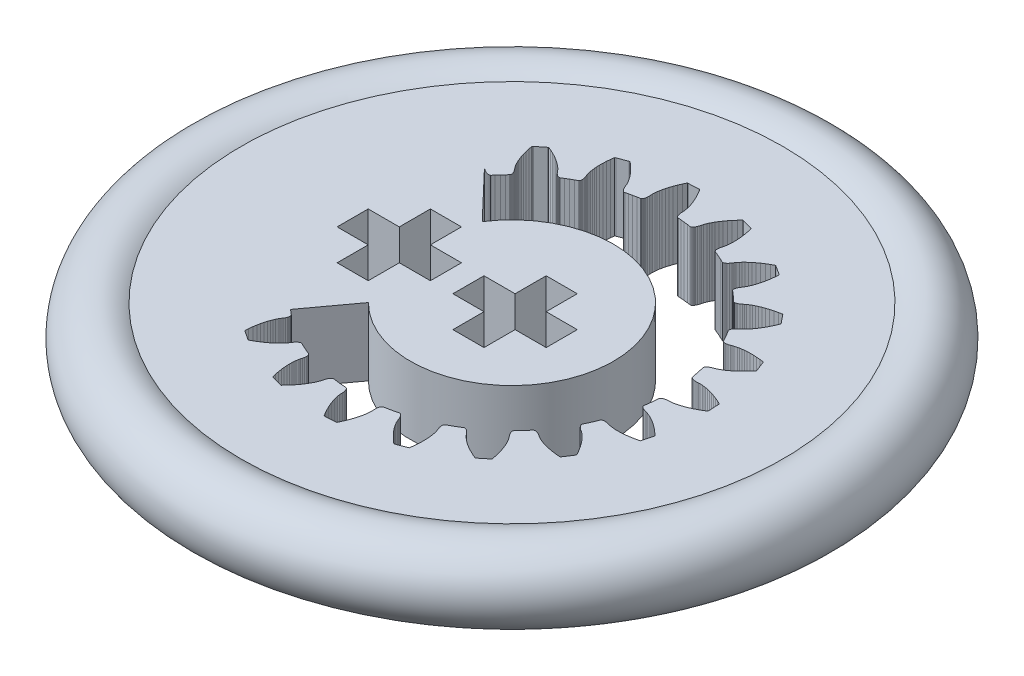
from build123d import *

# Parameters (mm, degrees)
CUT_EXTRUDE1_DEPTH = 3.81
CUT_EXTRUDE2_DEPTH = 3.81


with BuildPart() as part:
    # Sketch1 → Revolve1 (revolve)
    with BuildSketch(Plane.XY, mode=Mode.PRIVATE) as revolve1_sk:
        with BuildLine():
            Line((0, 0), (-11.938, 0))
            ThreePointArc((-11.938, 0), (-13.391464633, 1.982275638), (-11.063869511, 2.772387715))
            Line((-11.063869511, 2.772387715), (0, 2.772387715))
            Line((0, 2.772387715), (0, 0))
        make_face()
    revolve(revolve1_sk.sketch.rotate(Axis((0, 2.772387715, 0), (0, -1, 0)), 270), axis=Axis((0, 2.772387715, 0), (0, -1, 0)))

    # Sketch2 → Cut-Extrude1 (cut)
    with BuildSketch(Plane(origin=(0, 2.772387715, 0), x_dir=(1, 0, 0), z_dir=(0, 1, 0))):
        with BuildLine():
            Line((-2.93915524, -2.926183431), (-4.284595536, -4.758591682))
            Line((-4.284595536, -4.758591682), (-4.171431355, -4.858021964))
            Line((-4.171431355, -4.858021964), (-4.081176642, -4.934136064))
            Line((-4.081176642, -4.934136064), (-4.068215493, -4.948388256))
            Line((-4.068215493, -4.948388256), (-4.060784036, -4.962366284))
            Line((-4.060784036, -4.962366284), (-4.055257468, -4.979029391))
            Line((-4.055257468, -4.979029391), (-4.052769284, -4.998073857))
            Line((-4.052769284, -4.998073857), (-4.05246945, -5.019322489))
            Line((-4.05246945, -5.019322489), (-4.05520297, -5.042961191))
            Line((-4.05520297, -5.042961191), (-4.060410144, -5.068330017))
            Line((-4.060410144, -5.068330017), (-4.068538881, -5.095699183))
            Line((-4.068538881, -5.095699183), (-4.094270067, -5.155924585))
            Line((-4.094270067, -5.155924585), (-4.132073548, -5.222486974))
            Line((-4.132073548, -5.222486974), (-4.163646074, -5.268762823))
            Line((-4.163646074, -5.268762823), (-4.196070741, -5.321186598))
            Line((-4.196070741, -5.321186598), (-4.245515385, -5.417784815))
            Line((-4.245515385, -5.417784815), (-4.274333193, -5.483566779))
            Line((-4.274333193, -5.483566779), (-4.304747667, -5.561297927))
            Line((-4.304747667, -5.561297927), (-4.335379879, -5.651767425))
            Line((-4.335379879, -5.651767425), (-4.365851505, -5.755047192))
            Line((-4.365851505, -5.755047192), (-4.394647035, -5.869960289))
            Line((-4.394647035, -5.869960289), (-4.420948592, -5.997933379))
            Line((-4.420948592, -5.997933379), (-4.443804903, -6.138411436))
            Line((-4.443804903, -6.138411436), (-4.462111792, -6.291697687))
            Line((-4.462111792, -6.291697687), (-4.473990716, -6.441905705))
            Line((-4.473990716, -6.441905705), (-4.440589277, -6.464837711))
            Line((-4.440589277, -6.464837711), (-4.099968973, -6.685936383))
            Line((-4.099968973, -6.685936383), (-4.065323094, -6.707191768))
            Line((-4.065323094, -6.707191768), (-3.932984623, -6.635205185))
            Line((-3.932984623, -6.635205185), (-3.800343514, -6.556098794))
            Line((-3.800343514, -6.556098794), (-3.681199255, -6.478176532))
            Line((-3.681199255, -6.478176532), (-3.575348521, -6.402273348))
            Line((-3.575348521, -6.402273348), (-3.481879523, -6.329053238))
            Line((-3.481879523, -6.329053238), (-3.399623961, -6.259212118))
            Line((-3.399623961, -6.259212118), (-3.32990871, -6.194404519))
            Line((-3.32990871, -6.194404519), (-3.270878963, -6.135127436))
            Line((-3.270878963, -6.135127436), (-3.222731675, -6.082115924))
            Line((-3.222731675, -6.082115924), (-3.154611974, -5.997707848))
            Line((-3.154611974, -5.997707848), (-3.119748154, -5.946732833))
            Line((-3.119748154, -5.946732833), (-3.090202601, -5.899118668))
            Line((-3.090202601, -5.899118668), (-3.044937433, -5.837353527))
            Line((-3.044937433, -5.837353527), (-3.000484944, -5.789338021))
            Line((-3.000484944, -5.789338021), (-2.978731163, -5.770803146))
            Line((-2.978731163, -5.770803146), (-2.95753217, -5.755712702))
            Line((-2.95753217, -5.755712702), (-2.93713021, -5.743596824))
            Line((-2.93713021, -5.743596824), (-2.917660906, -5.735236449))
            Line((-2.917660906, -5.735236449), (-2.899402654, -5.729747067))
            Line((-2.899402654, -5.729747067), (-2.88179859, -5.728073078))
            Line((-2.88179859, -5.728073078), (-2.865747221, -5.729171175))
            Line((-2.865747221, -5.729171175), (-2.847361771, -5.735297691))
            Line((-2.847361771, -5.735297691), (-2.741728563, -5.786773021))
            Line((-2.741728563, -5.786773021), (-2.604368171, -5.849540156))
            Line((-2.604368171, -5.849540156), (-2.465798567, -5.909443171))
            Line((-2.465798567, -5.909443171), (-2.356725547, -5.953851466))
            Line((-2.356725547, -5.953851466), (-2.339994032, -5.963127899))
            Line((-2.339994032, -5.963127899), (-2.328595368, -5.974170891))
            Line((-2.328595368, -5.974170891), (-2.318094977, -5.988566279))
            Line((-2.318094977, -5.988566279), (-2.309935487, -6.005927512))
            Line((-2.309935487, -6.005927512), (-2.30298889, -6.026166606))
            Line((-2.30298889, -6.026166606), (-2.298281955, -6.048993714))
            Line((-2.298281955, -6.048993714), (-2.295642976, -6.074867164))
            Line((-2.295642976, -6.074867164), (-2.294903857, -6.103434403))
            Line((-2.294903857, -6.103434403), (-2.300383236, -6.168673939))
            Line((-2.300383236, -6.168673939), (-2.316204399, -6.243931732))
            Line((-2.316204399, -6.243931732), (-2.331784498, -6.297680867))
            Line((-2.331784498, -6.297680867), (-2.346563412, -6.357233108))
            Line((-2.346563412, -6.357233108), (-2.363669895, -6.46449165))
            Line((-2.363669895, -6.46449165), (-2.370819398, -6.535689387))
            Line((-2.370819398, -6.535689387), (-2.375258252, -6.619578126))
            Line((-2.375258252, -6.619578126), (-2.376800472, -6.714639409))
            Line((-2.376800472, -6.714639409), (-2.373750212, -6.82251306))
            Line((-2.373750212, -6.82251306), (-2.365509238, -6.940966438))
            Line((-2.365509238, -6.940966438), (-2.351144658, -7.070639744))
            Line((-2.351144658, -7.070639744), (-2.329293513, -7.211117715))
            Line((-2.329293513, -7.211117715), (-2.299539941, -7.362497056))
            Line((-2.299539941, -7.362497056), (-2.264164383, -7.509382053))
            Line((-2.264164383, -7.509382053), (-2.22537787, -7.520982381))
            Line((-2.22537787, -7.520982381), (-1.833669602, -7.625940295))
            Line((-1.833669602, -7.625940295), (-1.793867153, -7.635397816))
            Line((-1.793867153, -7.635397816), (-1.690132005, -7.52578742))
            Line((-1.690132005, -7.52578742), (-1.588331502, -7.409657887))
            Line((-1.588331502, -7.409657887), (-1.499512353, -7.298833932))
            Line((-1.499512353, -7.298833932), (-1.421823429, -7.193826288))
            Line((-1.421823429, -7.193826288), (-1.355528544, -7.095344734))
            Line((-1.355528544, -7.095344734), (-1.299293599, -7.003356506))
            Line((-1.299293599, -7.003356506), (-1.25268638, -6.920370353))
            Line((-1.25268638, -6.920370353), (-1.215067047, -6.845372296))
            Line((-1.215067047, -6.845372296), (-1.185591134, -6.780156903))
            Line((-1.185591134, -6.780156903), (-1.146845208, -6.678696632))
            Line((-1.146845208, -6.678696632), (-1.129455822, -6.619843865))
            Line((-1.129455822, -6.619843865), (-1.116074015, -6.565505699))
            Line((-1.116074015, -6.565505699), (-1.092077952, -6.492438364))
            Line((-1.092077952, -6.492438364), (-1.064615646, -6.433089136))
            Line((-1.064615646, -6.433089136), (-1.04969193, -6.408718741))
            Line((-1.04969193, -6.408718741), (-1.034469782, -6.387631165))
            Line((-1.034469782, -6.387631165), (-1.01863642, -6.370307814))
            Line((-1.01863642, -6.370307814), (-1.002844427, -6.356161506))
            Line((-1.002844427, -6.356161506), (-0.986754001, -6.345298019))
            Line((-0.986754001, -6.345298019), (-0.970806185, -6.337989406))
            Line((-0.970806185, -6.337989406), (-0.955069673, -6.334217262))
            Line((-0.955069673, -6.334217262), (-0.93594154, -6.334549393))
            Line((-0.93594154, -6.334549393), (-0.819208689, -6.350645599))
            Line((-0.819208689, -6.350645599), (-0.669321081, -6.368034461))
            Line((-0.669321081, -6.368034461), (-0.519323408, -6.382264687))
            Line((-0.519323408, -6.382264687), (-0.401692521, -6.390612792))
            Line((-0.401692521, -6.390612792), (-0.382775693, -6.39448139))
            Line((-0.382775693, -6.39448139), (-0.368325751, -6.401556095))
            Line((-0.368325751, -6.401556095), (-0.354260662, -6.411715808))
            Line((-0.354260662, -6.411715808), (-0.340849761, -6.425690915))
            Line((-0.340849761, -6.425690915), (-0.328237732, -6.442647456))
            Line((-0.328237732, -6.442647456), (-0.316558359, -6.463359502))
            Line((-0.316558359, -6.463359502), (-0.306156895, -6.486917262))
            Line((-0.306156895, -6.486917262), (-0.296585006, -6.513845826))
            Line((-0.296585006, -6.513845826), (-0.281683594, -6.577765162))
            Line((-0.281683594, -6.577765162), (-0.273365379, -6.653887927))
            Line((-0.273365379, -6.653887927), (-0.271585262, -6.70989578))
            Line((-0.271585262, -6.70989578), (-0.267291995, -6.771362905))
            Line((-0.267291995, -6.771362905), (-0.250433945, -6.8785407))
            Line((-0.250433945, -6.8785407), (-0.234830747, -6.948634104))
            Line((-0.234830747, -6.948634104), (-0.213691511, -7.029392401))
            Line((-0.213691511, -7.029392401), (-0.185445346, -7.120448682))
            Line((-0.185445346, -7.120448682), (-0.149542679, -7.221950204))
            Line((-0.149542679, -7.221950204), (-0.105137511, -7.332113586))
            Line((-0.105137511, -7.332113586), (-0.051034977, -7.450876119))
            Line((-0.051034977, -7.450876119), (0.01314463, -7.577919862))
            Line((0.01314463, -7.577919862), (0.088145999, -7.712663888))
            Line((0.088145999, -7.712663888), (0.16707719, -7.841260006))
            Line((0.16707719, -7.841260006), (0.20778466, -7.84019549))
            Line((0.20778466, -7.84019549), (0.612921392, -7.818921814))
            Line((0.612921392, -7.818921814), (0.65330702, -7.815760993))
            Line((0.65330702, -7.815760993), (0.71810297, -7.679732049))
            Line((0.71810297, -7.679732049), (0.778946821, -7.537843543))
            Line((0.778946821, -7.537843543), (0.829336747, -7.404743095))
            Line((0.829336747, -7.404743095), (0.870511127, -7.280755167))
            Line((0.870511127, -7.280755167), (0.903435326, -7.166948343))
            Line((0.903435326, -7.166948343), (0.92861731, -7.06225122))
            Line((0.92861731, -7.06225122), (0.947035259, -6.968508921))
            Line((0.947035259, -6.968508921), (0.959918349, -6.886080253))
            Line((0.959918349, -6.886080253), (0.967852377, -6.814702497))
            Line((0.967852377, -6.814702497), (0.973262472, -6.706305258))
            Line((0.973262472, -6.706305258), (0.971503688, -6.644722054))
            Line((0.971503688, -6.644722054), (0.967257784, -6.588848687))
            Line((0.967257784, -6.588848687), (0.967401764, -6.512195464))
            Line((0.967401764, -6.512195464), (0.975594697, -6.447270702))
            Line((0.975594697, -6.447270702), (0.982225847, -6.419500259))
            Line((0.982225847, -6.419500259), (0.990084711, -6.394841951))
            Line((0.990084711, -6.394841951), (0.999543633, -6.373005315))
            Line((0.999543633, -6.373005315), (1.010400135, -6.354746014))
            Line((1.010400135, -6.354746014), (1.022482509, -6.339605717))
            Line((1.022482509, -6.339605717), (1.035208639, -6.327833406))
            Line((1.035208639, -6.327833406), (1.048990706, -6.319539524))
            Line((1.048990706, -6.319539524), (1.067348357, -6.31367918))
            Line((1.067348357, -6.31367918), (1.18316984, -6.29278303))
            Line((1.18316984, -6.29278303), (1.331245259, -6.263351688))
            Line((1.331245259, -6.263351688), (1.478434678, -6.230082493))
            Line((1.478434678, -6.230082493), (1.592655867, -6.201968967))
            Line((1.592655867, -6.201968967), (1.611901358, -6.199939606))
            Line((1.611901358, -6.199939606), (1.627750248, -6.201793365))
            Line((1.627750248, -6.201793365), (1.644282729, -6.207416018))
            Line((1.644282729, -6.207416018), (1.661455285, -6.216420395))
            Line((1.661455285, -6.216420395), (1.678931797, -6.228686983))
            Line((1.678931797, -6.228686983), (1.696263858, -6.244515316))
            Line((1.696263858, -6.244515316), (1.713384614, -6.263880117))
            Line((1.713384614, -6.263880117), (1.730841798, -6.286935514))
            Line((1.730841798, -6.286935514), (1.764567223, -6.342704441))
            Line((1.764567223, -6.342704441), (1.79624336, -6.412716296))
            Line((1.79624336, -6.412716296), (1.814860975, -6.465239652))
            Line((1.814860975, -6.465239652), (1.838381539, -6.52227224))
            Line((1.838381539, -6.52227224), (1.887511484, -6.618924313))
            Line((1.887511484, -6.618924313), (1.923684974, -6.680944988))
            Line((1.923684974, -6.680944988), (1.969076793, -6.751429095))
            Line((1.969076793, -6.751429095), (2.024124373, -6.829293693))
            Line((2.024124373, -6.829293693), (2.08951468, -6.914722854))
            Line((2.08951468, -6.914722854), (2.165914645, -7.005502344))
            Line((2.165914645, -7.005502344), (2.253776282, -7.102143513))
            Line((2.253776282, -7.102143513), (2.354214857, -7.202957217))
            Line((2.354214857, -7.202957217), (2.467505156, -7.308017084))
            Line((2.467505156, -7.308017084), (2.58177132, -7.406137533))
            Line((2.58177132, -7.406137533), (2.62025638, -7.392483385))
            Line((2.62025638, -7.392483385), (2.999075788, -7.247124958))
            Line((2.999075788, -7.247124958), (3.036380262, -7.231556728))
            Line((3.036380262, -7.231556728), (3.056167166, -7.081869901))
            Line((3.056167166, -7.081869901), (3.070167198, -6.928224822))
            Line((3.070167198, -6.928224822), (3.077160879, -6.785889324))
            Line((3.077160879, -6.785889324), (3.077802634, -6.655443716))
            Line((3.077802634, -6.655443716), (3.073569476, -6.536871442))
            Line((3.073569476, -6.536871442), (3.065556939, -6.429656132))
            Line((3.065556939, -6.429656132), (3.054175293, -6.334739723))
            Line((3.054175293, -6.334739723), (3.040738978, -6.252437604))
            Line((3.040738978, -6.252437604), (3.026158937, -6.181823163))
            Line((3.026158937, -6.181823163), (2.997803533, -6.077160453))
            Line((2.997803533, -6.077160453), (2.977361575, -6.019355029))
            Line((2.977361575, -6.019355029), (2.956012519, -5.967682806))
            Line((2.956012519, -5.967682806), (2.932599472, -5.894311335))
            Line((2.932599472, -5.894311335), (2.920234385, -5.830269051))
            Line((2.920234385, -5.830269051), (2.917812163, -5.801663148))
            Line((2.917812163, -5.801663148), (2.91763897, -5.775655211))
            Line((2.91763897, -5.775655211), (2.920197526, -5.752367223))
            Line((2.920197526, -5.752367223), (2.924657947, -5.731598906))
            Line((2.924657947, -5.731598906), (2.931437936, -5.713440094))
            Line((2.931437936, -5.713440094), (2.939953536, -5.698146637))
            Line((2.939953536, -5.698146637), (2.950410837, -5.685773758))
            Line((2.950410837, -5.685773758), (2.96616146, -5.674804495))
            Line((2.96616146, -5.674804495), (3.06988155, -5.619108465))
            Line((3.06988155, -5.619108465), (3.201425976, -5.54530401))
            Line((3.201425976, -5.54530401), (3.33112626, -5.468214886))
            Line((3.33112626, -5.468214886), (3.43119974, -5.406343554))
            Line((3.43119974, -5.406343554), (3.448615437, -5.398228109))
            Line((3.448615437, -5.398228109), (3.464494793, -5.395296794))
            Line((3.464494793, -5.395296794), (3.482012202, -5.395594928))
            Line((3.482012202, -5.395594928), (3.501127828, -5.398721603))
            Line((3.501127828, -5.398721603), (3.521369928, -5.405338244))
            Line((3.521369928, -5.405338244), (3.542866762, -5.414691391))
            Line((3.542866762, -5.414691391), (3.565182741, -5.427857115))
            Line((3.565182741, -5.427857115), (3.588858304, -5.444192397))
            Line((3.588858304, -5.444192397), (3.6381407, -5.486966918))
            Line((3.6381407, -5.486966918), (3.689940399, -5.543978381))
            Line((3.689940399, -5.543978381), (3.724017663, -5.588267128))
            Line((3.724017663, -5.588267128), (3.763874577, -5.634892357))
            Line((3.763874577, -5.634892357), (3.840335239, -5.711705994))
            Line((3.840335239, -5.711705994), (3.894115696, -5.75967645))
            Line((3.894115696, -5.75967645), (3.958734105, -5.812538905))
            Line((3.958734105, -5.812538905), (4.035209941, -5.869786062))
            Line((4.035209941, -5.869786062), (4.124121711, -5.930358054))
            Line((4.124121711, -5.930358054), (4.224637763, -5.993236849))
            Line((4.224637763, -5.993236849), (4.337914965, -6.057951965))
            Line((4.337914965, -6.057951965), (4.464774139, -6.123088778))
            Line((4.464774139, -6.123088778), (4.604784767, -6.187780918))
            Line((4.604784767, -6.187780918), (4.744231074, -6.245511181))
            Line((4.744231074, -6.245511181), (4.776424432, -6.220989661))
            Line((4.776424432, -6.220989661), (5.091681676, -5.965518222))
            Line((5.091681676, -5.965518222), (5.122835523, -5.939105693))
            Line((5.122835523, -5.939105693), (5.09499295, -5.791036299))
            Line((5.09499295, -5.791036299), (5.060616903, -5.640421074))
            Line((5.060616903, -5.640421074), (5.023502831, -5.503046952))
            Line((5.023502831, -5.503046952), (4.983818829, -5.378561377))
            Line((4.983818829, -5.378561377), (4.943311175, -5.267042031))
            Line((4.943311175, -5.267042031), (4.902041273, -5.167710176))
            Line((4.902041273, -5.167710176), (4.862142401, -5.081122695))
            Line((4.862142401, -5.081122695), (4.823882053, -5.006556072))
            Line((4.823882053, -5.006556072), (4.788155127, -4.944242731))
            Line((4.788155127, -4.944242731), (4.729024805, -4.853312116))
            Line((4.729024805, -4.853312116), (4.691380532, -4.804474504))
            Line((4.691380532, -4.804474504), (4.655190026, -4.762027179))
            Line((4.655190026, -4.762027179), (4.610411497, -4.699696132))
            Line((4.610411497, -4.699696132), (4.579043398, -4.642548781))
            Line((4.579043398, -4.642548781), (4.567761385, -4.615957183))
            Line((4.567761385, -4.615957183), (4.559614166, -4.5914057))
            Line((4.559614166, -4.5914057), (4.554496892, -4.56846128))
            Line((4.554496892, -4.56846128), (4.552613812, -4.547186014))
            Line((4.552613812, -4.547186014), (4.55338465, -4.527822013))
            Line((4.55338465, -4.527822013), (4.556780544, -4.510751777))
            Line((4.556780544, -4.510751777), (4.563141297, -4.496081081))
            Line((4.563141297, -4.496081081), (4.57449871, -4.480348936))
            Line((4.57449871, -4.480348936), (4.655914621, -4.395505523))
            Line((4.655914621, -4.395505523), (4.758339081, -4.284741375))
            Line((4.758339081, -4.284741375), (4.857898082, -4.171206725))
            Line((4.857898082, -4.171206725), (4.933894014, -4.081310583))
            Line((4.933894014, -4.081310583), (4.948115046, -4.06835581))
            Line((4.948115046, -4.06835581), (4.96227859, -4.06056174))
            Line((4.96227859, -4.06056174), (4.978828559, -4.055402453))
            Line((4.978828559, -4.055402453), (4.997999902, -4.05255067))
            Line((4.997999902, -4.05255067), (5.019212346, -4.052248502))
            Line((5.019212346, -4.052248502), (5.042849207, -4.054988892))
            Line((5.042849207, -4.054988892), (5.068156664, -4.060562492))
            Line((5.068156664, -4.060562492), (5.095501539, -4.068699446))
            Line((5.095501539, -4.068699446), (5.155788803, -4.094034887))
            Line((5.155788803, -4.094034887), (5.222277432, -4.132223562))
            Line((5.222277432, -4.132223562), (5.268525801, -4.163788725))
            Line((5.268525801, -4.163788725), (5.320949577, -4.196213393))
            Line((5.320949577, -4.196213393), (5.417552823, -4.245666747))
            Line((5.417552823, -4.245666747), (5.483382875, -4.27449744))
            Line((5.483382875, -4.27449744), (5.561187784, -4.304526719))
            Line((5.561187784, -4.304526719), (5.651475446, -4.335507804))
            Line((5.651475446, -4.335507804), (5.754784533, -4.365979924))
            Line((5.754784533, -4.365979924), (5.869900074, -4.394432103))
            Line((5.869900074, -4.394432103), (5.997818206, -4.420718934))
            Line((5.997818206, -4.420718934), (6.138218857, -4.443561866))
            Line((6.138218857, -4.443561866), (6.291541296, -4.461871089))
            Line((6.291541296, -4.461871089), (6.441725024, -4.473758231))
            Line((6.441725024, -4.473758231), (6.464734437, -4.44037017))
            Line((6.464734437, -4.44037017), (6.685711261, -4.100122176))
            Line((6.685711261, -4.100122176), (6.706994124, -4.065483659))
            Line((6.706994124, -4.065483659), (6.635060694, -3.932754472))
            Line((6.635060694, -3.932754472), (6.555863613, -3.800479296))
            Line((6.555863613, -3.800479296), (6.478003179, -3.681351603))
            Line((6.478003179, -3.681351603), (6.402133885, -3.57512708))
            Line((6.402133885, -3.57512708), (6.328904704, -3.481582023))
            Line((6.328904704, -3.481582023), (6.259014967, -3.399755207))
            Line((6.259014967, -3.399755207), (6.194223838, -3.329676225))
            Line((6.194223838, -3.329676225), (6.134898139, -3.271075224))
            Line((6.134898139, -3.271075224), (6.081942113, -3.22250103))
            Line((6.081942113, -3.22250103), (5.997623343, -3.154405259))
            Line((5.997623343, -3.154405259), (5.946501334, -3.119870196))
            Line((5.946501334, -3.119870196), (5.898882501, -3.090397021))
            Line((5.898882501, -3.090397021), (5.837108289, -3.045055794))
            Line((5.837108289, -3.045055794), (5.78917795, -3.00025798))
            Line((5.78917795, -3.00025798), (5.770704901, -2.978520766))
            Line((5.770704901, -2.978520766), (5.755529291, -2.957667098))
            Line((5.755529291, -2.957667098), (5.743399673, -2.937261456))
            Line((5.743399673, -2.937261456), (5.734979674, -2.917849804))
            Line((5.734979674, -2.917849804), (5.729532037, -2.899160965))
            Line((5.729532037, -2.899160965), (5.72782097, -2.88191511))
            Line((5.72782097, -2.88191511), (5.728953415, -2.865872945))
            Line((5.728953415, -2.865872945), (5.735040915, -2.847550669))
            Line((5.735040915, -2.847550669), (5.786647297, -2.741510803))
            Line((5.786647297, -2.741510803), (5.849349875, -2.604501257))
            Line((5.849349875, -2.604501257), (5.909213873, -2.465994828))
            Line((5.909213873, -2.465994828), (5.953626836, -2.35684943))
            Line((5.953626836, -2.35684943), (5.962877993, -2.340184771))
            Line((5.962877993, -2.340184771), (5.974065776, -2.328383131))
            Line((5.974065776, -2.328383131), (5.98834852, -2.3182207))
            Line((5.98834852, -2.3182207), (6.005794919, -2.309715886))
            Line((6.005794919, -2.309715886), (6.025900759, -2.303101729))
            Line((6.025900759, -2.303101729), (6.048826772, -2.298053151))
            Line((6.048826772, -2.298053151), (6.074713962, -2.295417854))
            Line((6.074713962, -2.295417854), (6.103329289, -2.294691619))
            Line((6.103329289, -2.294691619), (6.168389684, -2.300564772))
            Line((6.168389684, -2.300564772), (6.243686493, -2.31632276))
            Line((6.243686493, -2.31632276), (6.297456237, -2.331908381))
            Line((6.297456237, -2.331908381), (6.357127993, -2.346351174))
            Line((6.357127993, -2.346351174), (6.464386536, -2.363457657))
            Line((6.464386536, -2.363457657), (6.535584272, -2.370607161))
            Line((6.535584272, -2.370607161), (6.619396917, -2.375467398))
            Line((6.619396917, -2.375467398), (6.714520555, -2.376584553))
            Line((6.714520555, -2.376584553), (6.82230217, -2.373877777))
            Line((6.82230217, -2.373877777), (6.94075088, -2.365709181))
            Line((6.94075088, -2.365709181), (7.070472802, -2.350915854))
            Line((7.070472802, -2.350915854), (7.210899955, -2.329419236))
            Line((7.210899955, -2.329419236), (7.362391941, -2.299327704))
            Line((7.362391941, -2.299327704), (7.509152756, -2.264360644))
            Line((7.509152756, -2.264360644), (7.520785759, -2.225067484))
            Line((7.520785759, -2.225067484), (7.625743673, -1.833359216))
            Line((7.625743673, -1.833359216), (7.635186926, -1.793994717))
            Line((7.635186926, -1.793994717), (7.525682306, -1.689919768))
            Line((7.525682306, -1.689919768), (7.409440128, -1.588457226))
            Line((7.409440128, -1.588457226), (7.29866699, -1.499283549))
            Line((7.29866699, -1.499283549), (7.193610731, -1.422023371))
            Line((7.193610731, -1.422023371), (7.095133844, -1.355656108))
            Line((7.095133844, -1.355656108), (7.003237652, -1.29907768))
            Line((7.003237652, -1.29907768), (6.920189143, -1.252895526))
            Line((6.920189143, -1.252895526), (6.845267181, -1.214854809))
            Line((6.845267181, -1.214854809), (6.780051788, -1.185378896))
            Line((6.780051788, -1.185378896), (6.678609924, -1.146564273))
            Line((6.678609924, -1.146564273), (6.619619235, -1.129579704))
            Line((6.619619235, -1.129579704), (6.56526046, -1.116192376))
            Line((6.56526046, -1.116192376), (6.49215411, -1.092259487))
            Line((6.49215411, -1.092259487), (6.432984021, -1.064403408))
            Line((6.432984021, -1.064403408), (6.408565538, -1.049466807))
            Line((6.408565538, -1.049466807), (6.387464223, -1.034240978))
            Line((6.387464223, -1.034240978), (6.370041966, -1.018749258))
            Line((6.370041966, -1.018749258), (6.356028913, -1.002624826))
            Line((6.356028913, -1.002624826), (6.345061852, -0.986948422))
            Line((6.345061852, -0.986948422), (6.337884292, -0.970593947))
            Line((6.337884292, -0.970593947), (6.333985764, -0.955191715))
            Line((6.333985764, -0.955191715), (6.334306356, -0.936134119))
            Line((6.334306356, -0.936134119), (6.350416302, -0.81940495))
            Line((6.350416302, -0.81940495), (6.36784418, -0.669454168))
            Line((6.36784418, -0.669454168), (6.382138963, -0.519105648))
            Line((6.382138963, -0.519105648), (6.390356016, -0.401881419))
            Line((6.390356016, -0.401881419), (6.394245224, -0.382970113))
            Line((6.394245224, -0.382970113), (6.401303987, -0.368442271))
            Line((6.401303987, -0.368442271), (6.411500779, -0.354018973))
            Line((6.411500779, -0.354018973), (6.425452546, -0.340969962))
            Line((6.425452546, -0.340969962), (6.442450306, -0.328368978))
            Line((6.442450306, -0.328368978), (6.463157684, -0.316761983))
            Line((6.463157684, -0.316761983), (6.486837425, -0.305877801))
            Line((6.486837425, -0.305877801), (6.513685754, -0.296358042))
            Line((6.513685754, -0.296358042), (6.577519924, -0.281801955))
            Line((6.577519924, -0.281801955), (6.653670167, -0.273491102))
            Line((6.653670167, -0.273491102), (6.709664281, -0.271707304))
            Line((6.709664281, -0.271707304), (6.771278399, -0.26708528))
            Line((6.771278399, -0.26708528), (6.878385296, -0.250134604))
            Line((6.878385296, -0.250134604), (6.948423214, -0.234958311))
            Line((6.948423214, -0.234958311), (7.02921172, -0.213459025))
            Line((7.02921172, -0.213459025), (7.120233124, -0.185645288))
            Line((7.120233124, -0.185645288), (7.221783263, -0.149313875))
            Line((7.221783263, -0.149313875), (7.331974123, -0.10491607))
            Line((7.331974123, -0.10491607), (7.45068804, -0.051242282))
            Line((7.45068804, -0.051242282), (7.577688363, 0.013022588))
            Line((7.577688363, 0.013022588), (7.712517556, 0.088369281))
            Line((7.712517556, 0.088369281), (7.841069725, 0.166944103))
            Line((7.841069725, 0.166944103), (7.839959324, 0.20759024))
            Line((7.839959324, 0.20759024), (7.818816699, 0.61313363))
            Line((7.818816699, 0.61313363), (7.815580312, 0.653539505))
            Line((7.815580312, 0.653539505), (7.679571977, 0.718329933))
            Line((7.679571977, 0.718329933), (7.537649123, 0.779182988))
            Line((7.537649123, 0.779182988), (7.404624242, 0.829552666))
            Line((7.404624242, 0.829552666), (7.28069127, 0.870712321))
            Line((7.28069127, 0.870712321), (7.166689366, 0.903320646))
            Line((7.166689366, 0.903320646), (7.061964764, 0.928509994))
            Line((7.061964764, 0.928509994), (6.968396937, 0.947249337))
            Line((6.968396937, 0.947249337), (6.885885304, 0.959712884))
            Line((6.885885304, 0.959712884), (6.814477867, 0.967728494))
            Line((6.814477867, 0.967728494), (6.706073759, 0.973140429))
            Line((6.706073759, 0.973140429), (6.644472148, 0.97131295))
            Line((6.644472148, 0.97131295), (6.588626259, 0.967059683))
            Line((6.588626259, 0.967059683), (6.512056001, 0.967623205))
            Line((6.512056001, 0.967623205), (6.447080421, 0.97546161))
            Line((6.447080421, 0.97546161), (6.419330587, 0.982087238))
            Line((6.419330587, 0.982087238), (6.394729967, 0.990298789))
            Line((6.394729967, 0.990298789), (6.372893331, 0.999757712))
            Line((6.372893331, 0.999757712), (6.354686785, 1.010673706))
            Line((6.354686785, 1.010673706), (6.339390159, 1.022282566))
            Line((6.339390159, 1.022282566), (6.327742031, 1.035417195))
            Line((6.327742031, 1.035417195), (6.319273677, 1.048877868))
            Line((6.319273677, 1.048877868), (6.313440811, 1.067228156))
            Line((6.313440811, 1.067228156), (6.292657307, 1.183387599))
            Line((6.292657307, 1.183387599), (6.26310645, 1.331126898))
            Line((6.26310645, 1.331126898), (6.229802906, 1.478325521))
            Line((6.229802906, 1.478325521), (6.201815764, 1.59288099))
            Line((6.201815764, 1.59288099), (6.199735585, 1.611771953))
            Line((6.199735585, 1.611771953), (6.201647033, 1.62797353))
            Line((6.201647033, 1.62797353), (6.207255946, 1.644509692))
            Line((6.207255946, 1.644509692), (6.216182026, 1.661335084))
            Line((6.216182026, 1.661335084), (6.228448614, 1.678811595))
            Line((6.228448614, 1.678811595), (6.244352513, 1.696123409))
            Line((6.244352513, 1.696123409), (6.263761263, 1.713600533))
            Line((6.263761263, 1.713600533), (6.286844139, 1.731050354))
            Line((6.286844139, 1.731050354), (6.342564978, 1.764788664))
            Line((6.342564978, 1.764788664), (6.412425172, 1.796063666))
            Line((6.412425172, 1.796063666), (6.465086449, 1.815086098))
            Line((6.465086449, 1.815086098), (6.522008594, 1.838194482))
            Line((6.522008594, 1.838194482), (6.618685944, 1.887391283))
            Line((6.618685944, 1.887391283), (6.680887961, 1.923884326))
            Line((6.680887961, 1.923884326), (6.751204466, 1.96895291))
            Line((6.751204466, 1.96895291), (6.829055324, 2.024004172))
            Line((6.829055324, 2.024004172), (6.914555912, 2.089743484))
            Line((6.914555912, 2.089743484), (7.005410969, 2.166123201))
            Line((7.005410969, 2.166123201), (7.101905144, 2.253656081))
            Line((7.101905144, 2.253656081), (7.202739457, 2.354089134))
            Line((7.202739457, 2.354089134), (7.307808396, 2.467303373))
            Line((7.307808396, 2.467303373), (7.406071434, 2.582046732))
            Line((7.406071434, 2.582046732), (7.392295835, 2.620490706))
            Line((7.392295835, 2.620490706), (7.247010772, 2.999364085))
            Line((7.247010772, 2.999364085), (7.231387585, 3.036683284))
            Line((7.231387585, 3.036683284), (7.081751047, 3.056383085))
            Line((7.081751047, 3.056383085), (6.928043613, 3.069958052))
            Line((6.928043613, 3.069958052), (6.785630346, 3.0770462))
            Line((6.785630346, 3.0770462), (6.655276775, 3.078031438))
            Line((6.655276775, 3.078031438), (6.536773197, 3.073779872))
            Line((6.536773197, 3.073779872), (6.429397154, 3.06544226))
            Line((6.429397154, 3.06544226), (6.334528833, 3.054047729))
            Line((6.334528833, 3.054047729), (6.252151147, 3.040631662))
            Line((6.252151147, 3.040631662), (6.181697439, 3.026376697))
            Line((6.181697439, 3.026376697), (6.077073745, 2.998084467))
            Line((6.077073745, 2.998084467), (6.019118862, 2.977167155))
            Line((6.019118862, 2.977167155), (5.967490323, 2.955953651))
            Line((5.967490323, 2.955953651), (5.894213091, 2.932809869))
            Line((5.894213091, 2.932809869), (5.830046624, 2.920036283))
            Line((5.830046624, 2.920036283), (5.801369822, 2.917706687))
            Line((5.801369822, 2.917706687), (5.775563836, 2.917847527))
            Line((5.775563836, 2.917847527), (5.752156333, 2.920069962))
            Line((5.752156333, 2.920069962), (5.731339928, 2.924543268))
            Line((5.731339928, 2.924543268), (5.713201725, 2.931317735))
            Line((5.713201725, 2.931317735), (5.69788766, 2.939838857))
            Line((5.69788766, 2.939838857), (5.685682383, 2.950619393))
            Line((5.685682383, 2.950619393), (5.674591403, 2.966108115))
            Line((5.674591403, 2.966108115), (5.618962133, 3.070104832))
            Line((5.618962133, 3.070104832), (5.545164547, 3.201647417))
            Line((5.545164547, 3.201647417), (5.468162526, 3.33139799))
            Line((5.468162526, 3.33139799), (5.406059299, 3.431018205))
            Line((5.406059299, 3.431018205), (5.398026819, 3.448853445))
            Line((5.398026819, 3.448853445), (5.39515513, 3.464790453))
            Line((5.39515513, 3.464790453), (5.395414247, 3.482244687))
            Line((5.395414247, 3.482244687), (5.398524452, 3.500996582))
            Line((5.398524452, 3.500996582), (5.405040251, 3.521192074))
            Line((5.405040251, 3.521192074), (5.41456787, 3.543010303))
            Line((5.41456787, 3.543010303), (5.427729189, 3.565474719))
            Line((5.427729189, 3.565474719), (5.44413537, 3.589057656))
            Line((5.44413537, 3.589057656), (5.486868673, 3.638351097))
            Line((5.486868673, 3.638351097), (5.543733143, 3.689822039))
            Line((5.543733143, 3.689822039), (5.588037831, 3.723821402))
            Line((5.588037831, 3.723821402), (5.634759764, 3.764094177))
            Line((5.634759764, 3.764094177), (5.711642097, 3.840536432))
            Line((5.711642097, 3.840536432), (5.75946556, 3.893988132))
            Line((5.75946556, 3.893988132), (5.812365094, 3.958964749))
            Line((5.812365094, 3.958964749), (5.869575172, 4.035082377))
            Line((5.869575172, 4.035082377), (5.930121887, 4.123927291))
            Line((5.930121887, 4.123927291), (5.99318449, 4.224909493))
            Line((5.99318449, 4.224909493), (6.057833111, 4.338130884))
            Line((6.057833111, 4.338130884), (6.122859481, 4.464577878))
            Line((6.122859481, 4.464577878), (6.187655195, 4.605002527))
            Line((6.187655195, 4.605002527), (6.245252204, 4.744116394))
            Line((6.245252204, 4.744116394), (6.220836459, 4.776649555))
            Line((6.220836459, 4.776649555), (5.965452123, 5.091957088))
            Line((5.965452123, 5.091957088), (5.938848918, 5.122646625))
            Line((5.938848918, 5.122646625), (5.790938054, 5.095203347))
            Line((5.790938054, 5.095203347), (5.640288481, 5.060836503))
            Line((5.640288481, 5.060836503), (5.50282012, 5.023453167))
            Line((5.50282012, 5.023453167), (5.37849748, 4.984020022))
            Line((5.37849748, 4.984020022), (5.266831141, 4.94318361))
            Line((5.266831141, 4.94318361), (5.167584452, 4.902259033))
            Line((5.167584452, 4.902259033), (5.080891196, 4.862020359))
            Line((5.080891196, 4.862020359), (5.006450957, 4.824094291))
            Line((5.006450957, 4.824094291), (4.944107936, 4.788448946))
            Line((4.944107936, 4.788448946), (4.853213872, 4.729235202))
            Line((4.853213872, 4.729235202), (4.804328172, 4.691603814))
            Line((4.804328172, 4.691603814), (4.761935803, 4.655398583))
            Line((4.761935803, 4.655398583), (4.699508581, 4.610645823))
            Line((4.699508581, 4.610645823), (4.642319484, 4.578847137))
            Line((4.642319484, 4.578847137), (4.615776502, 4.56799387))
            Line((4.615776502, 4.56799387), (4.591279976, 4.559831926))
            Line((4.591279976, 4.559831926), (4.568335556, 4.554714652))
            Line((4.568335556, 4.554714652), (4.546975124, 4.552486248))
            Line((4.546975124, 4.552486248), (4.527597384, 4.553260767))
            Line((4.527597384, 4.553260767), (4.510564226, 4.55701487))
            Line((4.510564226, 4.55701487), (4.495828973, 4.563024777))
            Line((4.495828973, 4.563024777), (4.480165525, 4.574363783))
            Line((4.480165525, 4.574363783), (4.395405076, 4.656199237))
            Line((4.395405076, 4.656199237), (4.284450251, 4.758159387))
            Line((4.284450251, 4.758159387), (4.171046653, 4.858125045))
            Line((4.171046653, 4.858125045), (4.081092823, 4.93376829))
            Line((4.081092823, 4.93376829), (4.068117441, 4.947994844))
            Line((4.068117441, 4.947994844), (4.060442887, 4.962494509))
            Line((4.060442887, 4.962494509), (4.055304208, 4.979038956))
            Line((4.055304208, 4.979038956), (4.052418076, 4.998219503))
            Line((4.052418076, 4.998219503), (4.052136518, 5.019426424))
            Line((4.052136518, 5.019426424), (4.054752725, 5.042654787))
            Line((4.054752725, 5.042654787), (4.060285107, 5.067973288))
            Line((4.060285107, 5.067973288), (4.068532505, 5.095730343))
            Line((4.068532505, 5.095730343), (4.093796518, 5.155668602))
            Line((4.093796518, 5.155668602), (4.132097838, 5.222495192))
            Line((4.132097838, 5.222495192), (4.16370422, 5.268732517))
            Line((4.16370422, 5.268732517), (4.195926936, 5.32084226))
            Line((4.195926936, 5.32084226), (4.245442117, 5.41742894))
            Line((4.245442117, 5.41742894), (4.274254403, 5.483190295))
            Line((4.274254403, 5.483190295), (4.304414735, 5.561401862))
            Line((4.304414735, 5.561401862), (4.335239755, 5.651436826))
            Line((4.335239755, 5.651436826), (4.365769034, 5.754656969))
            Line((4.365769034, 5.754656969), (4.394278901, 5.870125197))
            Line((4.394278901, 5.870125197), (4.420508044, 5.997690642))
            Line((4.420508044, 5.997690642), (4.443417471, 6.138147104))
            Line((4.443417471, 6.138147104), (4.461752235, 6.291757215))
            Line((4.461752235, 6.291757215), (4.473646246, 6.441939102))
            Line((4.473646246, 6.441939102), (4.440363961, 6.465288317))
            Line((4.440363961, 6.465288317), (4.100136576, 6.686259618))
            Line((4.100136576, 6.686259618), (4.065330457, 6.707219247))
            Line((4.065330457, 6.707219247), (3.932663097, 6.63526925))
            Line((3.932663097, 6.63526925), (3.800339833, 6.556085054))
            Line((3.800339833, 6.556085054), (3.681253358, 6.478213576))
            Line((3.681253358, 6.478213576), (3.57490932, 6.402008162))
            Line((3.57490932, 6.402008162), (3.481364263, 6.32877898))
            Line((3.481364263, 6.32877898), (3.399629483, 6.259232727))
            Line((3.399629483, 6.259232727), (3.329527162, 6.194079707))
            Line((3.329527162, 6.194079707), (3.270839057, 6.134703719))
            Line((3.270839057, 6.134703719), (3.222301677, 6.081885086))
            Line((3.222301677, 6.081885086), (3.154118803, 5.997516026))
            Line((3.154118803, 5.997516026), (3.11976288, 5.946787791))
            Line((3.11976288, 5.946787791), (3.090202601, 5.899118668))
            Line((3.090202601, 5.899118668), (3.044838034, 5.836982565))
            Line((3.044838034, 5.836982565), (3.00006356, 5.789414116))
            Line((3.00006356, 5.789414116), (2.978215902, 5.770528888))
            Line((2.978215902, 5.770528888), (2.957430931, 5.755334871))
            Line((2.957430931, 5.755334871), (2.937067036, 5.74363584))
            Line((2.937067036, 5.74363584), (2.917563348, 5.734872357))
            Line((2.917563348, 5.734872357), (2.899053649, 5.729818494))
            Line((2.899053649, 5.729818494), (2.88169735, 5.727695246))
            Line((2.88169735, 5.727695246), (2.865747221, 5.729171175))
            Line((2.865747221, 5.729171175), (2.847351317, 5.734983888))
            Line((2.847351317, 5.734983888), (2.741293043, 5.786521573))
            Line((2.741293043, 5.786521573), (2.604375534, 5.849567635))
            Line((2.604375534, 5.849567635), (2.465777069, 5.90908815))
            Line((2.465777069, 5.90908815), (2.35663167, 5.953501113))
            Line((2.35663167, 5.953501113), (2.33999035, 5.96311416))
            Line((2.33999035, 5.96311416), (2.328257407, 5.974283536))
            Line((2.328257407, 5.974283536), (2.318094977, 5.988566279))
            Line((2.318094977, 5.988566279), (2.309498127, 6.005669196))
            Line((2.309498127, 6.005669196), (2.302883969, 6.025775035))
            Line((2.302883969, 6.025775035), (2.297927428, 6.049044532))
            Line((2.297927428, 6.049044532), (2.29529213, 6.074931721))
            Line((2.29529213, 6.074931721), (2.294565896, 6.103547048))
            Line((2.294565896, 6.103547048), (2.300457455, 6.168676141))
            Line((2.300457455, 6.168676141), (2.316123408, 6.243629466))
            Line((2.316123408, 6.243629466), (2.331690622, 6.297330514))
            Line((2.331690622, 6.297330514), (2.346156754, 6.35736416))
            Line((2.346156754, 6.35736416), (2.363239897, 6.464260812))
            Line((2.363239897, 6.464260812), (2.37041274, 6.535820439))
            Line((2.37041274, 6.535820439), (2.375231231, 6.619202497))
            Line((2.375231231, 6.619202497), (2.37645883, 6.714738315))
            Line((2.37645883, 6.714738315), (2.37364161, 6.82210775))
            Line((2.37364161, 6.82210775), (2.365473014, 6.94055646))
            Line((2.365473014, 6.94055646), (2.350698095, 7.070347078))
            Line((2.350698095, 7.070347078), (2.32931192, 7.211186412))
            Line((2.32931192, 7.211186412), (2.29920198, 7.362609701))
            Line((2.29920198, 7.362609701), (2.264074187, 7.509045439))
            Line((2.264074187, 7.509045439), (2.224960168, 7.521072215))
            Line((2.224960168, 7.521072215), (1.8332519, 7.626030129))
            Line((1.8332519, 7.626030129), (1.793776957, 7.635061202))
            Line((1.793776957, 7.635061202), (1.689794044, 7.525900065))
            Line((1.689794044, 7.525900065), (1.58834991, 7.409726584))
            Line((1.58834991, 7.409726584), (1.499065789, 7.298541267))
            Line((1.499065789, 7.298541267), (1.421787205, 7.19341631))
            Line((1.421787205, 7.19341631), (1.355419941, 7.094939423))
            Line((1.355419941, 7.094939423), (1.298951957, 7.003455411))
            Line((1.298951957, 7.003455411), (1.252659359, 6.919994723))
            Line((1.252659359, 6.919994723), (1.214660389, 6.845503348))
            Line((1.214660389, 6.845503348), (1.185161136, 6.779926065))
            Line((1.185161136, 6.779926065), (1.14643855, 6.678827684))
            Line((1.14643855, 6.678827684), (1.129361945, 6.619493512))
            Line((1.129361945, 6.619493512), (1.115993024, 6.565203434))
            Line((1.115993024, 6.565203434), (1.09215217, 6.492440566))
            Line((1.09215217, 6.492440566), (1.064277685, 6.433201781))
            Line((1.064277685, 6.433201781), (1.049341084, 6.408783298))
            Line((1.049341084, 6.408783298), (1.034115254, 6.387681983))
            Line((1.034115254, 6.387681983), (1.018531499, 6.369916243))
            Line((1.018531499, 6.369916243), (1.002407067, 6.35590319))
            Line((1.002407067, 6.35590319), (0.986754001, 6.345298019))
            Line((0.986754001, 6.345298019), (0.970468224, 6.338102051))
            Line((0.970468224, 6.338102051), (0.955065992, 6.334203523))
            Line((0.955065992, 6.334203523), (0.935847663, 6.33419904))
            Line((0.935847663, 6.33419904), (0.81918719, 6.350290578))
            Line((0.81918719, 6.350290578), (0.669328444, 6.36806194))
            Line((0.669328444, 6.36806194), (0.518887889, 6.38201324))
            Line((0.518887889, 6.38201324), (0.401682067, 6.390298989))
            Line((0.401682067, 6.390298989), (0.382775693, 6.39448139))
            Line((0.382775693, 6.39448139), (0.368224512, 6.401178264))
            Line((0.368224512, 6.401178264), (0.353911657, 6.411787235))
            Line((0.353911657, 6.411787235), (0.340752202, 6.425326823))
            Line((0.340752202, 6.425326823), (0.328174558, 6.442686472))
            Line((0.328174558, 6.442686472), (0.316457119, 6.462981671))
            Line((0.316457119, 6.462981671), (0.305641635, 6.486643005))
            Line((0.305641635, 6.486643005), (0.296163622, 6.513921921))
            Line((0.296163622, 6.513921921), (0.281584195, 6.5773942))
            Line((0.281584195, 6.5773942), (0.273365379, 6.653887927))
            Line((0.273365379, 6.653887927), (0.271599988, 6.709950738))
            Line((0.271599988, 6.709950738), (0.266798823, 6.771171083))
            Line((0.266798823, 6.771171083), (0.250003948, 6.878309862))
            Line((0.250003948, 6.878309862), (0.234790841, 6.948210386))
            Line((0.234790841, 6.948210386), (0.213309962, 7.029067589))
            Line((0.213309962, 7.029067589), (0.185450868, 7.120469291))
            Line((0.185450868, 7.120469291), (0.149027419, 7.221675946))
            Line((0.149027419, 7.221675946), (0.10469831, 7.331848399))
            Line((0.10469831, 7.331848399), (0.05108908, 7.450913162))
            Line((0.05108908, 7.450913162), (-0.013148311, 7.577906123))
            Line((-0.013148311, 7.577906123), (-0.088467526, 7.712727953))
            Line((-0.088467526, 7.712727953), (-0.167069827, 7.841287485))
            Line((-0.167069827, 7.841287485), (-0.207617058, 7.840518726))
            Line((-0.207617058, 7.840518726), (-0.613146708, 7.81937242))
            Line((-0.613146708, 7.81937242), (-0.65365149, 7.81579439))
            Line((-0.65365149, 7.81579439), (-0.718462526, 7.679791577))
            Line((-0.718462526, 7.679791577), (-0.779334253, 7.537579211))
            Line((-0.779334253, 7.537579211), (-0.829777295, 7.404500359))
            Line((-0.829777295, 7.404500359), (-0.870879262, 7.280920074))
            Line((-0.870879262, 7.280920074), (-0.903517797, 7.16655812))
            Line((-0.903517797, 7.16655812), (-0.928757434, 7.061920622))
            Line((-0.928757434, 7.061920622), (-0.947368191, 6.968612856))
            Line((-0.947368191, 6.968612856), (-0.959997139, 6.885703769))
            Line((-0.959997139, 6.885703769), (-0.967925645, 6.814346622))
            Line((-0.967925645, 6.814346622), (-0.973406277, 6.70596092))
            Line((-0.973406277, 6.70596092), (-0.971445543, 6.644691749))
            Line((-0.971445543, 6.644691749), (-0.967233494, 6.588856904))
            Line((-0.967233494, 6.588856904), (-0.967875313, 6.511939481))
            Line((-0.967875313, 6.511939481), (-0.975601073, 6.447301862))
            Line((-0.975601073, 6.447301862), (-0.982350884, 6.419143529))
            Line((-0.982350884, 6.419143529), (-0.990534956, 6.394535547))
            Line((-0.990534956, 6.394535547), (-0.999876565, 6.37310925))
            Line((-0.999876565, 6.37310925), (-1.010751342, 6.354891659))
            Line((-1.010751342, 6.354891659), (-1.022435768, 6.339615282))
            Line((-1.022435768, 6.339615282), (-1.035549789, 6.327961631))
            Line((-1.035549789, 6.327961631), (-1.049088758, 6.319146113))
            Line((-1.049088758, 6.319146113), (-1.067432176, 6.313311406))
            Line((-1.067432176, 6.313311406), (-1.183554541, 6.292886111))
            Line((-1.183554541, 6.292886111), (-1.331390544, 6.262919393))
            Line((-1.331390544, 6.262919393), (-1.478412229, 6.23008384))
            Line((-1.478412229, 6.23008384), (-1.59307814, 6.201684519))
            Line((-1.59307814, 6.201684519), (-1.611996583, 6.199611702))
            Line((-1.611996583, 6.199611702), (-1.62817482, 6.20188504))
            Line((-1.62817482, 6.20188504), (-1.644741191, 6.207133903))
            Line((-1.644741191, 6.207133903), (-1.661525365, 6.21604894))
            Line((-1.661525365, 6.21604894), (-1.67891671, 6.228660851))
            Line((-1.67891671, 6.228660851), (-1.696221654, 6.24456291))
            Line((-1.696221654, 6.24456291), (-1.713788084, 6.263995589))
            Line((-1.713788084, 6.263995589), (-1.73129339, 6.286651559))
            Line((-1.73129339, 6.286651559), (-1.764976215, 6.342799304))
            Line((-1.764976215, 6.342799304), (-1.796196259, 6.412644772))
            Line((-1.796196259, 6.412644772), (-1.8152393, 6.465311572))
            Line((-1.8152393, 6.465311572), (-1.838333944, 6.522230035))
            Line((-1.838333944, 6.522230035), (-1.887512338, 6.618976082))
            Line((-1.887512338, 6.618976082), (-1.923989441, 6.681100199))
            Line((-1.923989441, 6.681100199), (-1.969156931, 6.751075061))
            Line((-1.969156931, 6.751075061), (-2.024102417, 6.829265721))
            Line((-2.024102417, 6.829265721), (-2.089968113, 6.914432029))
            Line((-2.089968113, 6.914432029), (-2.166200837, 7.005615843))
            Line((-2.166200837, 7.005615843), (-2.253862303, 7.101849958))
            Line((-2.253862303, 7.101849958), (-2.354201118, 7.202953535))
            Line((-2.354201118, 7.202953535), (-2.467456575, 7.308033518))
            Line((-2.467456575, 7.308033518), (-2.582248551, 7.40586781))
            Line((-2.582248551, 7.40586781), (-2.620556805, 7.392571247))
            Line((-2.620556805, 7.392571247), (-2.999448591, 7.247217488))
            Line((-2.999448591, 7.247217488), (-3.036887305, 7.23125818))
            Line((-3.036887305, 7.23125818), (-3.056508808, 7.081968806))
            Line((-3.056508808, 7.081968806), (-3.070242306, 6.927862078))
            Line((-3.070242306, 6.927862078), (-3.077137575, 6.785838902))
            Line((-3.077137575, 6.785838902), (-3.078097537, 6.655552187))
            Line((-3.078097537, 6.655552187), (-3.074022909, 6.536580617))
            Line((-3.074022909, 6.536580617), (-3.065625671, 6.429262227))
            Line((-3.065625671, 6.429262227), (-3.054200931, 6.334753955))
            Line((-3.054200931, 6.334753955), (-3.040815073, 6.25201622))
            Line((-3.040815073, 6.25201622), (-3.026447463, 6.181900473))
            Line((-3.026447463, 6.181900473), (-2.998155233, 6.077276779))
            Line((-2.998155233, 6.077276779), (-2.97743767, 6.018933645))
            Line((-2.97743767, 6.018933645), (-2.956109584, 5.967348033))
            Line((-2.956109584, 5.967348033), (-2.932908114, 5.894423487))
            Line((-2.932908114, 5.894423487), (-2.920148268, 5.830260702))
            Line((-2.920148268, 5.830260702), (-2.917820873, 5.801658119))
            Line((-2.917820873, 5.801658119), (-2.917984788, 5.775711058))
            Line((-2.917984788, 5.775711058), (-2.920347347, 5.751972957))
            Line((-2.920347347, 5.751972957), (-2.92471294, 5.73120132))
            Line((-2.92471294, 5.73120132), (-2.931470937, 5.713426848))
            Line((-2.931470937, 5.713426848), (-2.939953043, 5.698175957))
            Line((-2.939953043, 5.698175957), (-2.950827552, 5.685922231))
            Line((-2.950827552, 5.685922231), (-2.966303064, 5.674385939))
            Line((-2.966303064, 5.674385939), (-3.070157191, 5.619233863))
            Line((-3.070157191, 5.619233863), (-3.201800619, 5.54538967))
            Line((-3.201800619, 5.54538967), (-3.331489366, 5.468371083))
            Line((-3.331489366, 5.468371083), (-3.431286254, 5.406020679))
            Line((-3.431286254, 5.406020679), (-3.44894482, 5.398235375))
            Line((-3.44894482, 5.398235375), (-3.464994473, 5.395025725))
            Line((-3.464994473, 5.395025725), (-3.482489925, 5.395295886))
            Line((-3.482489925, 5.395295886), (-3.501228081, 5.39840241))
            Line((-3.501228081, 5.39840241), (-3.521457921, 5.404927412))
            Line((-3.521457921, 5.404927412), (-3.543177244, 5.414796674))
            Line((-3.543177244, 5.414796674), (-3.565713088, 5.427608988))
            Line((-3.565713088, 5.427608988), (-3.589293823, 5.443940949))
            Line((-3.589293823, 5.443940949), (-3.638456211, 5.48708091))
            Line((-3.638456211, 5.48708091), (-3.690000782, 5.543670594))
            Line((-3.690000782, 5.543670594), (-3.724098787, 5.587854455))
            Line((-3.724098787, 5.587854455), (-3.764180885, 5.635040698))
            Line((-3.764180885, 5.635040698), (-3.840675895, 5.711863538))
            Line((-3.840675895, 5.711863538), (-3.894253979, 5.759352721))
            Line((-3.894253979, 5.759352721), (-3.959175639, 5.81223753))
            Line((-3.959175639, 5.81223753), (-4.035327615, 5.869456811))
            Line((-4.035327615, 5.869456811), (-4.124066754, 5.930343328))
            Line((-4.124066754, 5.930343328), (-4.225021477, 5.993398568))
            Line((-4.225021477, 5.993398568), (-4.338403601, 6.057722113))
            Line((-4.338403601, 6.057722113), (-4.464814045, 6.122665061))
            Line((-4.464814045, 6.122665061), (-4.605121381, 6.187871114))
            Line((-4.605121381, 6.187871114), (-4.744258059, 6.245547863))
            Line((-4.744258059, 6.245547863), (-4.776763741, 6.221124756))
            Line((-4.776763741, 6.221124756), (-5.092082812, 5.965669883))
            Line((-5.092082812, 5.965669883), (-5.122767681, 5.939139055))
            Line((-5.122767681, 5.939139055), (-5.095412035, 5.790736271))
            Line((-5.095412035, 5.790736271), (-5.061068002, 5.640166439))
            Line((-5.061068002, 5.640166439), (-5.02360223, 5.50267599))
            Line((-5.02360223, 5.50267599), (-4.984125137, 5.378709718))
            Line((-4.984125137, 5.378709718), (-4.943336813, 5.267056264))
            Line((-4.943336813, 5.267056264), (-4.902504271, 5.167466091))
            Line((-4.902504271, 5.167466091), (-4.862224379, 5.080761791))
            Line((-4.862224379, 5.080761791), (-4.824158187, 5.006652151))
            Line((-4.824158187, 5.006652151), (-4.788625488, 4.943971169))
            Line((-4.788625488, 4.943971169), (-4.729512587, 4.853030496))
            Line((-4.729512587, 4.853030496), (-4.691763885, 4.804555135))
            Line((-4.691763885, 4.804555135), (-4.655689707, 4.761756109))
            Line((-4.655689707, 4.761756109), (-4.610799026, 4.699733704))
            Line((-4.610799026, 4.699733704), (-4.57897973, 4.642539084))
            Line((-4.57897973, 4.642539084), (-4.568126463, 4.615996102))
            Line((-4.568126463, 4.615996102), (-4.560001598, 4.591141368))
            Line((-4.560001598, 4.591141368), (-4.554953021, 4.568215355))
            Line((-4.554953021, 4.568215355), (-4.552697138, 4.546847559))
            Line((-4.552697138, 4.546847559), (-4.553407099, 4.527820665))
            Line((-4.553407099, 4.527820665), (-4.557161203, 4.510787508))
            Line((-4.557161203, 4.510787508), (-4.563208188, 4.495694046))
            Line((-4.563208188, 4.495694046), (-4.574503246, 4.480386966))
            Line((-4.574503246, 4.480386966), (-4.656423866, 4.395281194))
            Line((-4.656423866, 4.395281194), (-4.758445843, 4.284342935))
            Line((-4.758445843, 4.284342935), (-4.858257638, 4.171266254))
            Line((-4.858257638, 4.171266254), (-4.93397918, 4.080965259))
            Line((-4.93397918, 4.080965259), (-4.948240083, 4.06799908))
            Line((-4.948240083, 4.06799908), (-4.962592754, 4.060653283))
            Line((-4.962592754, 4.060653283), (-4.979254513, 4.055104266))
            Line((-4.979254513, 4.055104266), (-4.998278731, 4.052691648))
            Line((-4.998278731, 4.052691648), (-5.019552147, 4.052354277))
            Line((-5.019552147, 4.052354277), (-5.042807989, 4.054977848))
            Line((-5.042807989, 4.054977848), (-5.068184178, 4.060157543))
            Line((-5.068184178, 4.060157543), (-5.095934363, 4.0684031))
            Line((-5.095934363, 4.0684031), (-5.155787456, 4.094012437))
            Line((-5.155787456, 4.094012437), (-5.222731358, 4.131903418))
            Line((-5.222731358, 4.131903418), (-5.268982423, 4.163513481))
            Line((-5.268982423, 4.163513481), (-5.32105315, 4.195799372))
            Line((-5.32105315, 4.195799372), (-3.476376666, 2.261855051))
            ThreePointArc((-3.476376666, 2.261855051), (4.125372496, 0.427182355), (-2.93915524, -2.926183431))
        make_face()
    extrude(amount=-CUT_EXTRUDE1_DEPTH, mode=Mode.SUBTRACT)

    # Sketch3 → Cut-Extrude2 (cut)
    with BuildSketch(Plane(origin=(0, 2.772387715, 0), x_dir=(1, 0, 0), z_dir=(0, 1, 0))):
        Polygon((-3.71349395, -2.159), (-4.98349395, -2.159), (-4.98349395, -0.889), (-6.25349395, -0.889), (-6.25349395, 0.381), (-4.98349395, 0.381), (-4.98349395, 1.651), (-3.71349395, 1.651), (-3.71349395, 0.381), (-2.44349395, 0.381), (-2.44349395, -0.889), (-3.71349395, -0.889), align=None)
        Polygon((1.01640078, -2.159), (-0.25359922, -2.159), (-0.25359922, -0.889), (-1.52359922, -0.889), (-1.52359922, 0.381), (-0.25359922, 0.381), (-0.25359922, 1.651), (1.01640078, 1.651), (1.01640078, 0.381), (2.28640078, 0.381), (2.28640078, -0.889), (1.01640078, -0.889), align=None)
    extrude(amount=-CUT_EXTRUDE2_DEPTH, mode=Mode.SUBTRACT)


solid = part.part
